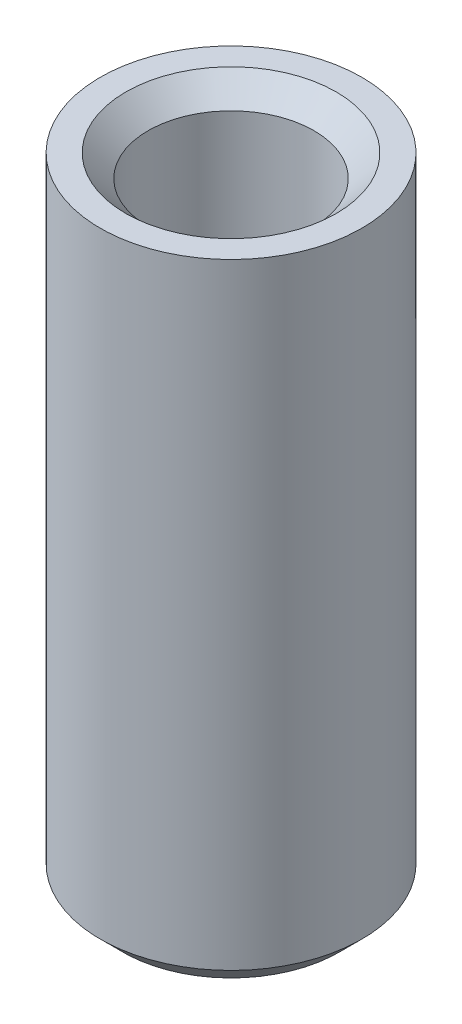
from build123d import *


with BuildPart() as part:
    # Sketch1 → Revolve1 (revolve)
    with BuildSketch(Plane.XY, mode=Mode.PRIVATE) as revolve1_sk:
        Polygon((-2.6, 0), (-3.4, 0), (-4.1, 0.7), (-4.1, 20), (-3.3, 20), (-2.6, 19.3), align=None)
    revolve(revolve1_sk.sketch.rotate(Axis((0, 0, 0), (0, 1, 0)), 270), axis=Axis((0, 0, 0), (0, 1, 0)))


solid = part.part
